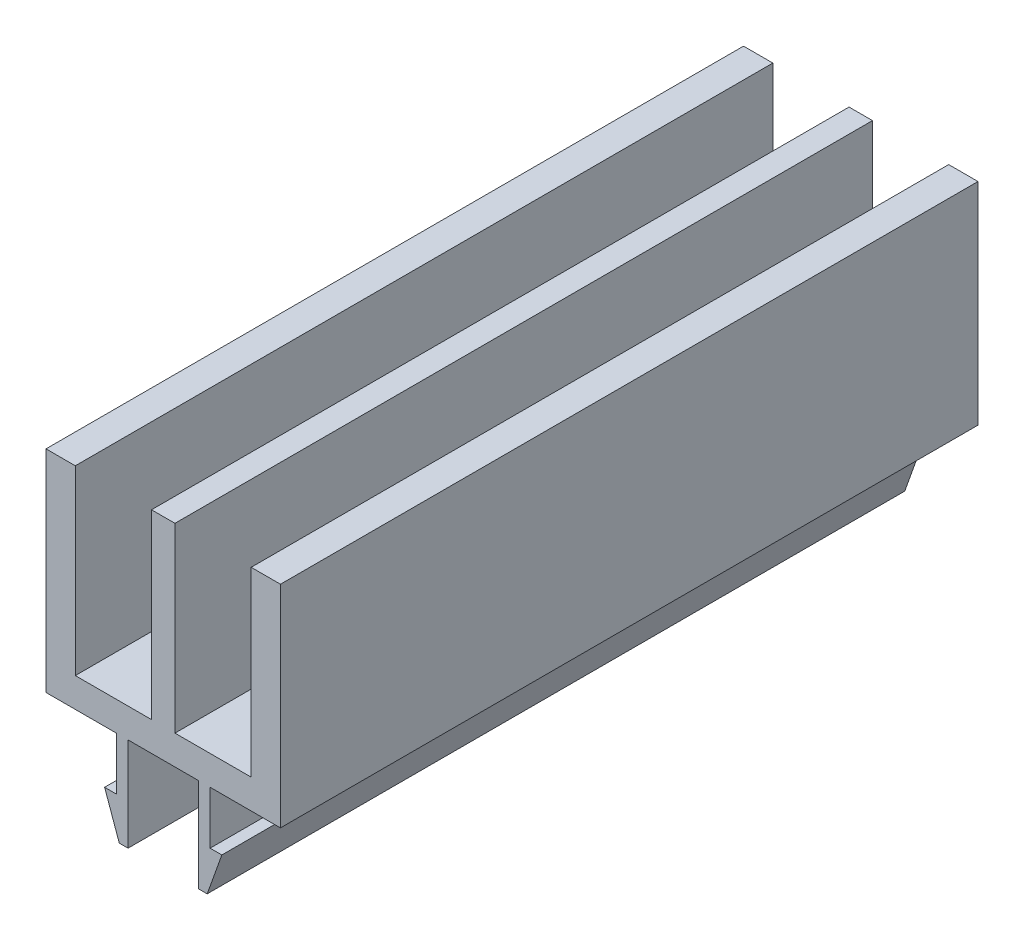
from build123d import *

# Parameters (mm, degrees)
BOSS_EXTRU_1_DEPTH = 59.5


with BuildPart() as part:
    # Esquisse1 → Boss.-Extru.1 (new body)
    with BuildSketch(Plane.XY.offset(50)):
        Polygon((-1, 2.5), (-7.5, 2.5), (-7.5, 17.999999998), (-10, 17.999999998), (-10, 0), (-4, 0), (-4, -4.5), (-5, -4.5), (-3.75, -8), (-3, -8), (-3, 0), (3, 0), (3, -8), (3.75, -8), (5, -4.5), (4, -4.5), (4, 0), (10, 0), (10, 17.999999998), (7.5, 17.999999998), (7.5, 2.5), (1, 2.5), (1, 17.999999998), (-1, 17.999999998), align=None)
    extrude(amount=-BOSS_EXTRU_1_DEPTH)


solid = part.part
